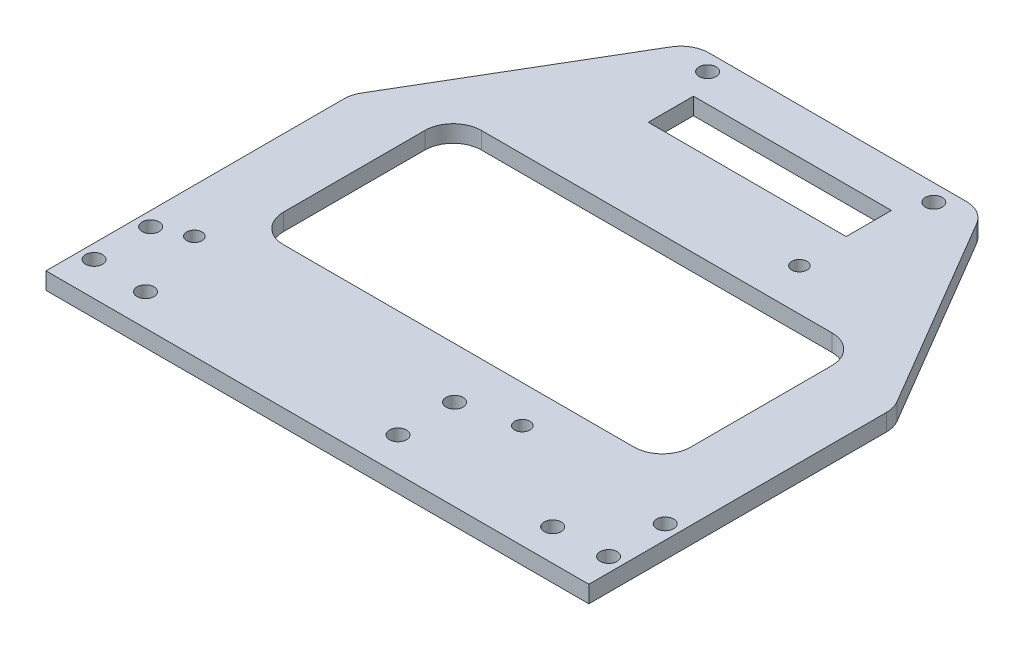
from build123d import *

# Parameters (mm, degrees)
SKETCH1_R           = 1.5
SKETCH1_R_2         = 1.65
SKETCH1_W           = 6
SKETCH1_H           = 28
BOSS_EXTRUDE1_DEPTH = 3
CUT_EXTRUDE2_REACH  = 109.373
SKETCH3_R           = 1.5
CUT_EXTRUDE3_REACH  = 109.373
SKETCH4_W           = 22.395
SKETCH4_H           = 68
SKETCH6_W           = 51.21
SKETCH6_H           = 5
BOSS_EXTRUDE2_DEPTH = 3
CUT_EXTRUDE4_REACH  = 109.373
SKETCH7_R           = 1.5
CUT_EXTRUDE5_REACH  = 109.373
SKETCH9_R           = 1.5
CUT_EXTRUDE6_REACH  = 109.373
SKETCH11_R          = 1.5
SKETCH11_R_2        = 2.5
BOSS_EXTRUDE3_DEPTH = 3
CUT_EXTRUDE7_REACH  = 109.373
CUT_EXTRUDE8_START  = -3
SKETCH13_W          = 4.95
SKETCH13_H          = 15
SKETCH13_W_2        = 6.078763038
SKETCH13_H_2        = 4.767996375
CUT_EXTRUDE8_DEPTH  = 3
BOSS_EXTRUDE4_DEPTH = 3
CUT_EXTRUDE9_REACH  = 120.849
SKETCH15_R          = 1.5
CUT_EXTRUDE10_DEPTH = 119.84864324
SKETCH19_W          = 9
SKETCH19_H          = 48.6
SKETCH19_W_2        = 31.468413904
SKETCH19_H_2        = 28.051944454
BOSS_EXTRUDE5_DEPTH = 3
SKETCH20_W          = 96
SKETCH20_H          = 16
CUT_EXTRUDE11_DEPTH = 108.373181009
SKETCH22_W          = 4.143615352
SKETCH22_H          = 3.607002568
BOSS_EXTRUDE6_DEPTH = 3
FILLET1_R           = 5
SKETCH23_R          = 1.35
CUT_EXTRUDE12_DEPTH = 94.343451832
CUT_EXTRUDE13_DEPTH = 94.343451832
SKETCH28_W          = 35
SKETCH28_H          = 8
CUT_EXTRUDE17_DEPTH = 94.343451832
SKETCH29_R          = 1.5
CUT_EXTRUDE18_DEPTH = 94.343451832


with BuildPart() as part:
    # Sketch1 → Boss-Extrude1 (new body)
    with BuildSketch(Plane(origin=(0, 0, 0), x_dir=(1, 0, 0), z_dir=(0, 1, 0))):
        Polygon((-48, -80), (-48, 80), (48, 80), (48, -80), (48, -96), (-48, -96), align=None)
        with Locations(Location((45.5, -74, 0), (0, 0, 270))):
            Circle(SKETCH1_R, mode=Mode.SUBTRACT)
        with Locations(Location((45.5, -64, 0), (0, 0, 270))):
            Circle(SKETCH1_R, mode=Mode.SUBTRACT)
        with Locations(Location((-45.5, -64, 0), (0, 0, 270))):
            Circle(SKETCH1_R, mode=Mode.SUBTRACT)
        with Locations(Location((-45.5, -74, 0), (0, 0, 270))):
            Circle(SKETCH1_R, mode=Mode.SUBTRACT)
        with Locations(Location((8.25, -74, 0), (0, 0, 270))):
            Circle(SKETCH1_R, mode=Mode.SUBTRACT)
        with Locations(Location((8.25, -64, 0), (0, 0, 270))):
            Circle(SKETCH1_R, mode=Mode.SUBTRACT)
        with Locations(Location((0.259511597, -37.46931278, 0), (0, 0, 270))):
            Circle(SKETCH1_R_2, mode=Mode.SUBTRACT)
        with Locations(Location((15.320886036, -37.46931278, 0), (0, 0, 270))):
            Circle(SKETCH1_R_2, mode=Mode.SUBTRACT)
        with Locations(Location((15.320886036, -52.53068722, 0), (0, 0, 270))):
            Circle(SKETCH1_R_2, mode=Mode.SUBTRACT)
        with Locations(Location((0.259511597, -52.53068722, 0), (0, 0, 270))):
            Circle(SKETCH1_R_2, mode=Mode.SUBTRACT)
        with Locations(Location((17.55, -90, 0), (0, 0, 270))):
            Circle(SKETCH1_R, mode=Mode.SUBTRACT)
        with Locations(Location((45.55, -90, 0), (0, 0, 270))):
            Circle(SKETCH1_R, mode=Mode.SUBTRACT)
        with Locations(Location((-45.55, -90, 0), (0, 0, 90))):
            Circle(SKETCH1_R, mode=Mode.SUBTRACT)
        with Locations(Location((-17.55, -90, 0), (0, 0, 90))):
            Circle(SKETCH1_R, mode=Mode.SUBTRACT)
        with Locations((22.5, -45.4)):
            Rectangle(SKETCH1_W, SKETCH1_H, mode=Mode.SUBTRACT)
        Polygon((43, -80), (34.5, -80), (34.5, -31.4), (43, -31.4), (43.5, -31.4), (43.5, -58), (43, -58), align=None, mode=Mode.SUBTRACT)
    extrude(amount=BOSS_EXTRUDE1_DEPTH)

    # Sketch3 → Cut-Extrude2 (cut, up to next)
    with BuildSketch(Plane(origin=(0, 3, 0), x_dir=(1, 0, 0), z_dir=(0, 1, 0)), mode=Mode.PRIVATE) as cut_extrude2_sk1:
        with Locations(Location((0, 9, 0), (0, 0, 270))):
            Circle(SKETCH3_R)
    cut_extrude2_tool1 = extrude(cut_extrude2_sk1.sketch, amount=-CUT_EXTRUDE2_REACH, mode=Mode.PRIVATE) & part.part
    add(cut_extrude2_tool1.solids().sort_by_distance((0, 3, -9))[0], mode=Mode.SUBTRACT)

    # Sketch4 → Cut-Extrude3 (cut, up to next)
    with BuildSketch(Plane(origin=(0, 3, 0), x_dir=(1, 0, 0), z_dir=(0, 1, 0)), mode=Mode.PRIVATE) as cut_extrude3_sk1:
        with Locations((36.8025, 46)):
            Rectangle(SKETCH4_W, SKETCH4_H)
    cut_extrude3_tool1 = extrude(cut_extrude3_sk1.sketch, amount=-CUT_EXTRUDE3_REACH, mode=Mode.PRIVATE) & part.part
    # Sketch4 → Cut-Extrude3 (cut, up to next)
    with BuildSketch(Plane(origin=(0, 3, 0), x_dir=(1, 0, 0), z_dir=(0, 1, 0)), mode=Mode.PRIVATE) as cut_extrude3_sk2:
        with Locations((-36.8025, 46)):
            Rectangle(SKETCH4_W, SKETCH4_H)
    cut_extrude3_tool2 = extrude(cut_extrude3_sk2.sketch, amount=-CUT_EXTRUDE3_REACH, mode=Mode.PRIVATE) & part.part
    add(cut_extrude3_tool1.solids().sort_by_distance((36.8025, 3, -46))[0], mode=Mode.SUBTRACT)
    add(cut_extrude3_tool2.solids().sort_by_distance((-36.8025, 3, -46))[0], mode=Mode.SUBTRACT)

    # Sketch6 → Boss-Extrude2 (add)
    with BuildSketch(Plane(origin=(0, 3, 0), x_dir=(1, 0, 0), z_dir=(0, 1, 0))):
        with Locations((0, 82.5)):
            Rectangle(SKETCH6_W, SKETCH6_H)
    extrude(amount=-BOSS_EXTRUDE2_DEPTH)

    # Sketch7 → Cut-Extrude4 (cut, up to next)
    with BuildSketch(Plane(origin=(0, 3, 0), x_dir=(1, 0, 0), z_dir=(0, 1, 0)), mode=Mode.PRIVATE) as cut_extrude4_sk1:
        with Locations(Location((-17.8495, 79.268380868, 0), (0, 0, 270))):
            Circle(SKETCH7_R)
    cut_extrude4_tool1 = extrude(cut_extrude4_sk1.sketch, amount=-CUT_EXTRUDE4_REACH, mode=Mode.PRIVATE) & part.part
    # Sketch7 → Cut-Extrude4 (cut, up to next)
    with BuildSketch(Plane(origin=(0, 3, 0), x_dir=(1, 0, 0), z_dir=(0, 1, 0)), mode=Mode.PRIVATE) as cut_extrude4_sk2:
        with Locations(Location((17.8495, 79.268380868, 0), (0, 0, 270))):
            Circle(SKETCH7_R)
    cut_extrude4_tool2 = extrude(cut_extrude4_sk2.sketch, amount=-CUT_EXTRUDE4_REACH, mode=Mode.PRIVATE) & part.part
    add(cut_extrude4_tool1.solids().sort_by_distance((-17.8495, 3, -79.268381))[0], mode=Mode.SUBTRACT)
    add(cut_extrude4_tool2.solids().sort_by_distance((17.8495, 3, -79.268381))[0], mode=Mode.SUBTRACT)

    # Sketch9 → Cut-Extrude5 (cut, up to next)
    with BuildSketch(Plane(origin=(0, 3, 0), x_dir=(1, 0, 0), z_dir=(0, 1, 0)), mode=Mode.PRIVATE) as cut_extrude5_sk1:
        with Locations(Location((-22.6907969, 44, 0), (0, 0, 270))):
            Circle(SKETCH9_R)
    cut_extrude5_tool1 = extrude(cut_extrude5_sk1.sketch, amount=-CUT_EXTRUDE5_REACH, mode=Mode.PRIVATE) & part.part
    # Sketch9 → Cut-Extrude5 (cut, up to next)
    with BuildSketch(Plane(origin=(0, 3, 0), x_dir=(1, 0, 0), z_dir=(0, 1, 0)), mode=Mode.PRIVATE) as cut_extrude5_sk2:
        with Locations(Location((22.6907969, 44, 0), (0, 0, 270))):
            Circle(SKETCH9_R)
    cut_extrude5_tool2 = extrude(cut_extrude5_sk2.sketch, amount=-CUT_EXTRUDE5_REACH, mode=Mode.PRIVATE) & part.part
    add(cut_extrude5_tool1.solids().sort_by_distance((-22.690797, 3, -44))[0], mode=Mode.SUBTRACT)
    add(cut_extrude5_tool2.solids().sort_by_distance((22.690797, 3, -44))[0], mode=Mode.SUBTRACT)

    # Sketch10 → Cut-Extrude6 (cut, up to next)
    with BuildSketch(Plane(origin=(0, 3, 0), x_dir=(1, 0, 0), z_dir=(0, 1, 0)), mode=Mode.PRIVATE) as cut_extrude6_sk1:
        Polygon((48, -26), (25.605, 12), (48, 12), align=None)
    cut_extrude6_tool1 = extrude(cut_extrude6_sk1.sketch, amount=-CUT_EXTRUDE6_REACH, mode=Mode.PRIVATE) & part.part
    # Sketch10 → Cut-Extrude6 (cut, up to next)
    with BuildSketch(Plane(origin=(0, 3, 0), x_dir=(1, 0, 0), z_dir=(0, 1, 0)), mode=Mode.PRIVATE) as cut_extrude6_sk2:
        Polygon((-48, -26), (-48, 12), (-25.605, 12), align=None)
    cut_extrude6_tool2 = extrude(cut_extrude6_sk2.sketch, amount=-CUT_EXTRUDE6_REACH, mode=Mode.PRIVATE) & part.part
    add(cut_extrude6_tool1.solids().sort_by_distance((40.535, 3, 0.666667))[0], mode=Mode.SUBTRACT)
    add(cut_extrude6_tool2.solids().sort_by_distance((-40.535, 3, 0.666667))[0], mode=Mode.SUBTRACT)

    # Sketch11 → Boss-Extrude3 (add)
    # profile 1 of 2: a face of its own
    with BuildSketch(Plane.XZ):
        with BuildLine():
            Line((-45.873798612, -40.351535952), (-25.605, -52.641311078))
            Line((-25.605, -52.641311078), (-25.605, -35.641311078))
            Line((-25.605, -35.641311078), (-31.796655586, -35.641311078))
            Line((-31.796655586, -35.641311078), (-42.885371512, -33.037114659))
            ThreePointArc((-42.885371512, -33.037114659), (-47.502761912, -35.418300045), (-45.873798612, -40.351535952))
        make_face()
        with Locations(Location((-32.930328676, -41.931167665, 0), (0, 0, 270))):
            Circle(SKETCH11_R, mode=Mode.SUBTRACT)
        with Locations(Location((-43.799893893, -36.931167665, 0), (0, 0, 270))):
            Circle(SKETCH11_R_2, mode=Mode.SUBTRACT)
    # profile 2 of 2: a face of its own
    with BuildSketch(Plane.XZ):
        with BuildLine():
            Line((25.605, -35.641311078), (25.605, -52.641311078))
            Line((25.605, -52.641311078), (45.873798612, -40.351535952))
            ThreePointArc((45.873798612, -40.351535952), (47.502761912, -35.418300045), (42.885371512, -33.037114659))
            Line((42.885371512, -33.037114659), (31.796655586, -35.641311078))
            Line((31.796655586, -35.641311078), (25.605, -35.641311078))
        make_face()
        with Locations(Location((32.930328676, -41.931167665, 0), (0, 0, 270))):
            Circle(SKETCH11_R, mode=Mode.SUBTRACT)
        with Locations(Location((43.799893893, -36.931167665, 0), (0, 0, 270))):
            Circle(SKETCH11_R_2, mode=Mode.SUBTRACT)
    extrude(amount=-BOSS_EXTRUDE3_DEPTH)

    # Sketch12 → Cut-Extrude7 (cut, up to next)
    with BuildSketch(Plane.XZ, mode=Mode.PRIVATE) as cut_extrude7_sk1:
        Polygon((-11.899893893, -39.441311078), (-11.899893893, -54.741311078), (12.200106107, -54.741311078), (12.200106107, -39.441311078), (17.036431901, -39.441311078), (17.164018107, -32.041311078), (12.200106107, -32.041311078), (12.200106107, -31.191311078), (12.200106107, -25.191311078), (12.200106107, -19.091311078), (-3.799893893, -19.091311078), (-3.799893893, -30.391311078), (-11.899893893, -30.391311078), (-11.899893893, -32.041311078), (-16.849893893, -32.041311078), (-16.849893893, -39.441311078), align=None)
    cut_extrude7_tool1 = extrude(cut_extrude7_sk1.sketch, amount=-CUT_EXTRUDE7_REACH, mode=Mode.PRIVATE) & part.part
    add(cut_extrude7_tool1.solids().sort_by_distance((1.013826, 0, -38.139532))[0], mode=Mode.SUBTRACT)

    # Sketch13 → Cut-Extrude8 (cut)
    with BuildSketch(Plane.XZ.offset(CUT_EXTRUDE8_START)):
        with Locations((-14.374893893, -36.541311078)):
            Rectangle(SKETCH13_W, SKETCH13_H)
        with Locations((14.675106107, -36.541311078)):
            Rectangle(SKETCH13_W, SKETCH13_H)
        with Locations((15.239487626, -48.991959171)):
            Rectangle(SKETCH13_W_2, SKETCH13_H_2)
    extrude(amount=CUT_EXTRUDE8_DEPTH, mode=Mode.SUBTRACT)

    # Sketch14 → Boss-Extrude4 (add)
    with BuildSketch(Plane.XZ):
        with BuildLine():
            Line((-62, -85), (-25.605, -85))
            Line((-25.605, -85), (-25.605, -72))
            Line((-25.605, -72), (-70, -72))
            Line((-70, -72), (-70, -77))
            ThreePointArc((-70, -77), (-67.656854249, -82.656854249), (-62, -85))
        make_face()
        with BuildLine():
            Line((25.605, -72), (25.605, -85))
            Line((25.605, -85), (62, -85))
            ThreePointArc((62, -85), (67.656854249, -82.656854249), (70, -77))
            Line((70, -77), (70, -72))
            Line((70, -72), (25.605, -72))
        make_face()
    extrude(amount=-BOSS_EXTRUDE4_DEPTH)

    # Sketch15 → Cut-Extrude9 (cut, up to next)
    with BuildSketch(Plane(origin=(0, 3, 0), x_dir=(1, 0, 0), z_dir=(0, 1, 0)), mode=Mode.PRIVATE) as cut_extrude9_sk1:
        with Locations(Location((-20, 9, 0), (0, 0, 270))):
            Circle(SKETCH15_R)
    cut_extrude9_tool1 = extrude(cut_extrude9_sk1.sketch, amount=-CUT_EXTRUDE9_REACH, mode=Mode.PRIVATE) & part.part
    # Sketch15 → Cut-Extrude9 (cut, up to next)
    with BuildSketch(Plane(origin=(0, 3, 0), x_dir=(1, 0, 0), z_dir=(0, 1, 0)), mode=Mode.PRIVATE) as cut_extrude9_sk2:
        with Locations(Location((20, 9, 0), (0, 0, 270))):
            Circle(SKETCH15_R)
    cut_extrude9_tool2 = extrude(cut_extrude9_sk2.sketch, amount=-CUT_EXTRUDE9_REACH, mode=Mode.PRIVATE) & part.part
    add(cut_extrude9_tool1.solids().sort_by_distance((-20, 3, -9))[0], mode=Mode.SUBTRACT)
    add(cut_extrude9_tool2.solids().sort_by_distance((20, 3, -9))[0], mode=Mode.SUBTRACT)

    # Sketch18 → Cut-Extrude10 (cut, through all)
    with BuildSketch(Plane(origin=(0, 3, 0), x_dir=(1, 0, 0), z_dir=(0, 1, 0))):
        Polygon((-87.931846418, 12), (-25.605, 12), (25.605, 12), (83.08251035, 12), (83.08251035, 92.113601242), (-87.931846418, 92.113601242), align=None)
    extrude(amount=-CUT_EXTRUDE10_DEPTH, mode=Mode.SUBTRACT)

    # Sketch19 → Boss-Extrude5 (add, through all)
    with BuildSketch(Plane(origin=(0, 3, 0), x_dir=(1, 0, 0), z_dir=(0, 1, 0))):
        with Locations((39, -55.7)):
            Rectangle(SKETCH19_W, SKETCH19_H)
        with Locations((9.765793048, -45.425972227)):
            Rectangle(SKETCH19_W_2, SKETCH19_H_2)
    extrude(amount=-BOSS_EXTRUDE5_DEPTH)

    # Sketch20 → Cut-Extrude11 (cut, through all)
    with BuildSketch(Plane(origin=(0, 3, 0), x_dir=(1, 0, 0), z_dir=(0, 1, 0))):
        with Locations((0, -88)):
            Rectangle(SKETCH20_W, SKETCH20_H)
    extrude(amount=-CUT_EXTRUDE11_DEPTH, mode=Mode.SUBTRACT)

    # Sketch22 → Boss-Extrude6 (add, through all)
    with BuildSketch(Plane(origin=(0, 3, 0), x_dir=(1, 0, 0), z_dir=(0, 1, 0))):
        with Locations((0, 9)):
            Rectangle(SKETCH22_W, SKETCH22_H)
    extrude(amount=-BOSS_EXTRUDE6_DEPTH)

    # Fillet1
    fillet1_edges = [part.edges().sort_by_distance(p)[0] for p in [
        (-25.605, 1.5, -12),
        (25.605, 1.5, -12),
        (48, 1.5, 26),
        (-48, 1.5, 26),
    ]]
    fillet(fillet1_edges, radius=FILLET1_R)

    # Sketch23 → Cut-Extrude12 (cut, through all)
    with BuildSketch(Plane(origin=(0, 3, 0), x_dir=(1, 0, 0), z_dir=(0, 1, 0))):
        with Locations(Location((-40.170591439, -61.590425785, 0), (0, 0, 270))):
            Circle(SKETCH23_R)
        with Locations(Location((17.829408561, -61.590425785, 0), (0, 0, 270))):
            Circle(SKETCH23_R)
        with Locations(Location((17.829408561, -12.590425785, 0), (0, 0, 270))):
            Circle(SKETCH23_R)
    extrude(amount=-CUT_EXTRUDE12_DEPTH, mode=Mode.SUBTRACT)

    # Sketch24 → Cut-Extrude13 (cut, through all)
    with BuildSketch(Plane(origin=(0, 3, 0), x_dir=(1, 0, 0), z_dir=(0, 1, 0))):
        with BuildLine():
            Line((31, -55), (-31, -55))
            ThreePointArc((-31, -55), (-34.535533906, -53.535533906), (-36, -50))
            Line((-36, -50), (-36, -25))
            ThreePointArc((-36, -25), (-34.535533906, -21.464466094), (-31, -20))
            Line((-31, -20), (31, -20))
            ThreePointArc((31, -20), (34.535533906, -21.464466094), (36, -25))
            Line((36, -25), (36, -50))
            ThreePointArc((36, -50), (34.535533906, -53.535533906), (31, -55))
        make_face()
    extrude(amount=-CUT_EXTRUDE13_DEPTH, mode=Mode.SUBTRACT)

    # Sketch28 → Cut-Extrude17 (cut, through all)
    with BuildSketch(Plane(origin=(0, 3, 0), x_dir=(1, 0, 0), z_dir=(0, 1, 0))):
        Rectangle(SKETCH28_W, SKETCH28_H)
    extrude(amount=-CUT_EXTRUDE17_DEPTH, mode=Mode.SUBTRACT)

    # Sketch29 → Cut-Extrude18 (cut, through all)
    with BuildSketch(Plane(origin=(0, 3, 0), x_dir=(1, 0, 0), z_dir=(0, 1, 0))):
        with Locations(Location((-36, -74.4, 0), (0, 0, 270))):
            Circle(SKETCH29_R)
        with Locations(Location((36, -74.4, 0), (0, 0, 90))):
            Circle(SKETCH29_R)
    extrude(amount=-CUT_EXTRUDE18_DEPTH, mode=Mode.SUBTRACT)


solid = part.part
